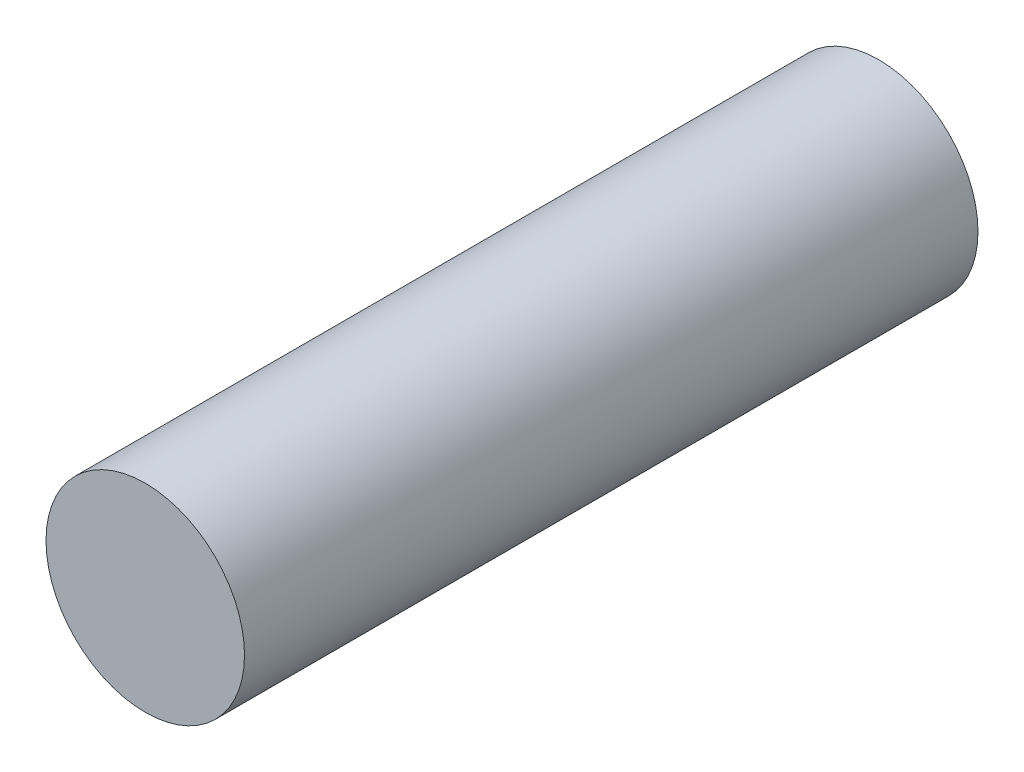
from build123d import *

# Parameters (mm, degrees)
SKETCH1_R           = 2
BOSS_EXTRUDE1_DEPTH = 14.78


with BuildPart() as part:
    # Sketch1 → Boss-Extrude1 (new body)
    with BuildSketch(Plane.XY):
        with Locations(Location((0, 0, 0), (0, 0, 180))):
            Circle(SKETCH1_R)
    extrude(amount=BOSS_EXTRUDE1_DEPTH)


solid = part.part
